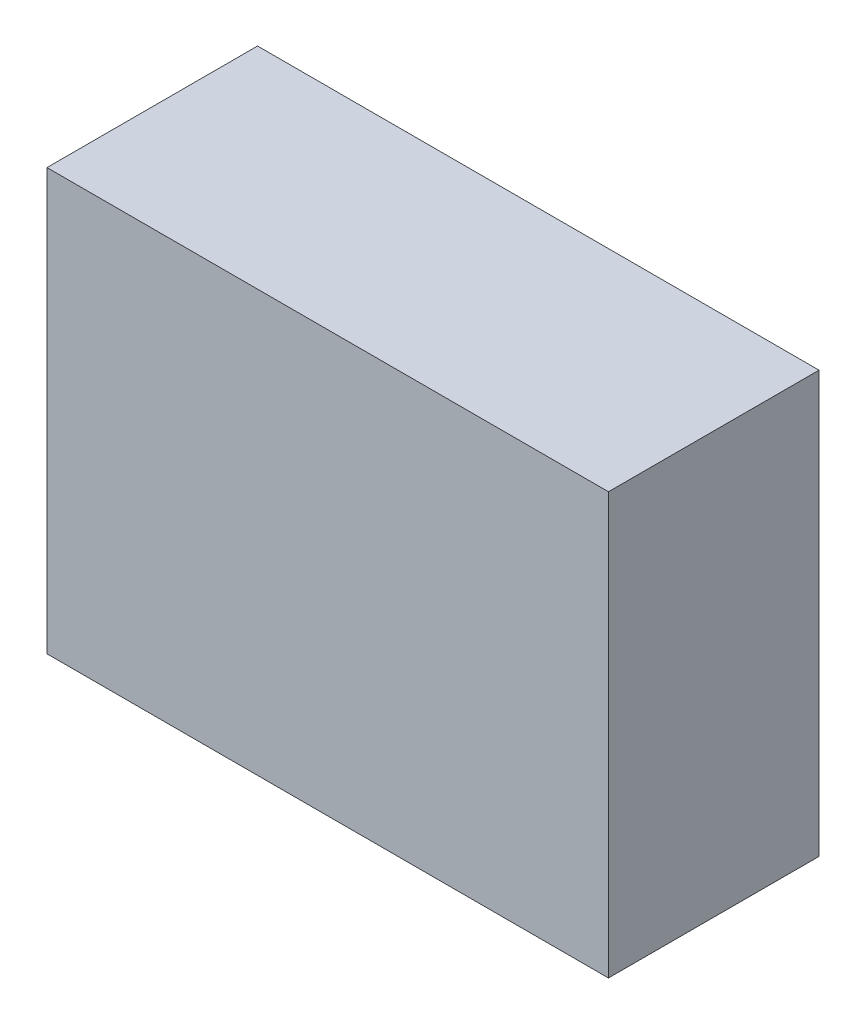
from build123d import *

# Parameters (mm, degrees)
SKETCH_1_W      = 8000
SKETCH_1_H      = 6000
EXTRUDE_1_DEPTH = 3000


with BuildPart() as part:
    # 草图1 → 凸台-拉伸1 (new body)
    with BuildSketch(Plane.XY):
        Rectangle(SKETCH_1_W, SKETCH_1_H)
    extrude(amount=EXTRUDE_1_DEPTH)


solid = part.part
